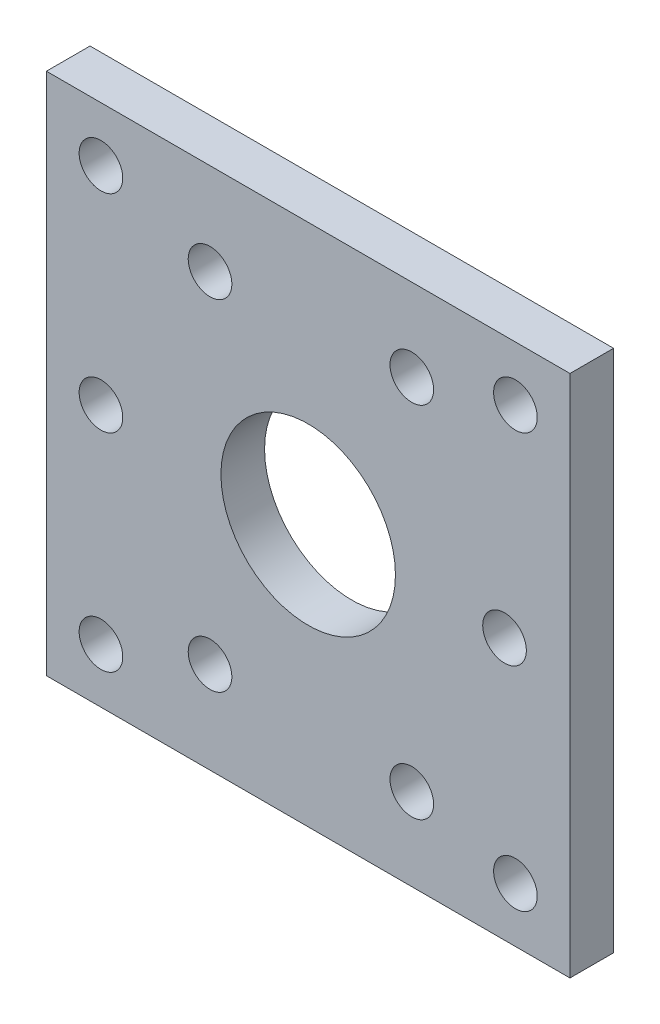
from build123d import *

# Parameters (mm, degrees)
SKETCH_3_W          = 60
SKETCH_3_H          = 60
SKETCH_3_R          = 10
EXTRUDE_2_DEPTH     = 5
SKETCH_4_R          = 2.5
CUT_EXTRUDE_1_DEPTH = 5


with BuildPart() as part:
    # 草图3 → 凸台-拉伸2 (new body)
    with BuildSketch(Plane.XY):
        Rectangle(SKETCH_3_W, SKETCH_3_H)
        Circle(SKETCH_3_R, mode=Mode.SUBTRACT)
    extrude(amount=EXTRUDE_2_DEPTH)

    # 草图4 → 切除-拉伸1 (cut)
    with BuildSketch(Plane.XY):
        with Locations(Location((11.875, 20.56810334, 0), (0, 0, 180))):
            Circle(SKETCH_4_R)
        with Locations(Location((22.5, 0, 0), (0, 0, 180))):
            Circle(SKETCH_4_R)
        with Locations(Location((11.875, -20.56810334, 0), (0, 0, 180))):
            Circle(SKETCH_4_R)
        with Locations(Location((-11.25, -19.485571585, 0), (0, 0, 180))):
            Circle(SKETCH_4_R)
        with Locations(Location((-23.75, 0, 0), (0, 0, 180))):
            Circle(SKETCH_4_R)
        with Locations(Location((-11.25, 19.485571585, 0), (0, 0, 180))):
            Circle(SKETCH_4_R)
        with Locations(Location((-23.75, 23.75, 0), (0, 0, 180))):
            Circle(SKETCH_4_R)
        with Locations(Location((23.75, 23.75, 0), (0, 0, 180))):
            Circle(SKETCH_4_R)
        with Locations(Location((23.75, -23.75, 0), (0, 0, 180))):
            Circle(SKETCH_4_R)
        with Locations(Location((-23.75, -23.75, 0), (0, 0, 180))):
            Circle(SKETCH_4_R)
    extrude(amount=CUT_EXTRUDE_1_DEPTH, mode=Mode.SUBTRACT)


solid = part.part
